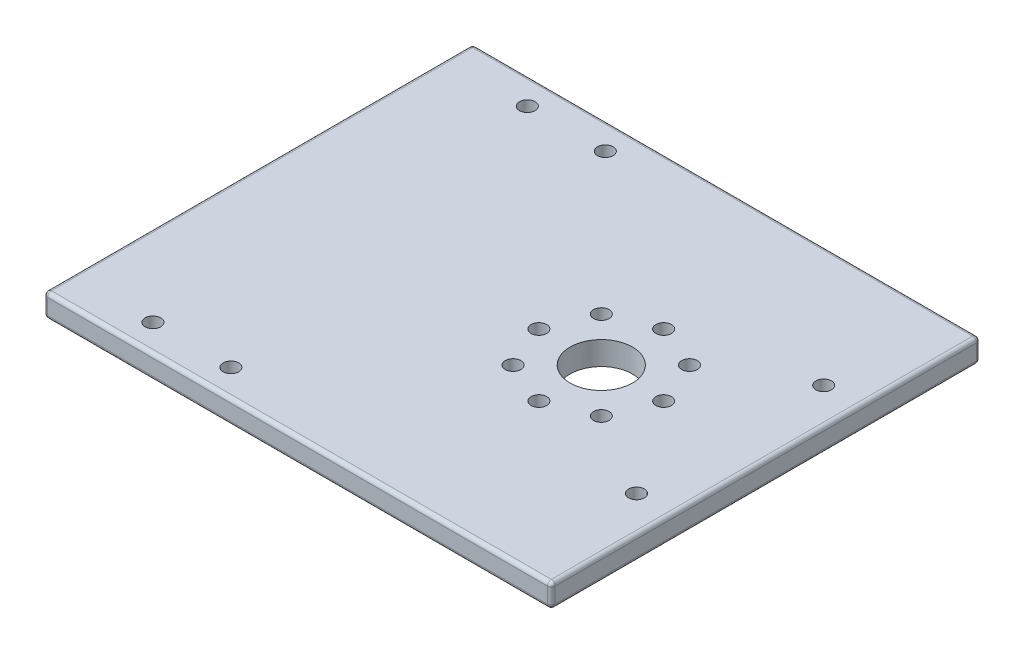
from build123d import *

# Parameters (mm, degrees)
SKETCH1_W           = 65.079845806
SKETCH1_H           = 55
SKETCH1_R           = 4
BOSS_EXTRUDE1_DEPTH = 3
SKETCH2_R           = 1
CUT_EXTRUDE1_DEPTH  = 3
FILLET1_R           = 0.5
SKETCH3_R           = 1
CUT_EXTRUDE2_DEPTH  = 52.961426281


with BuildPart() as part:
    # Sketch1 → Boss-Extrude1 (new body)
    with BuildSketch(Plane(origin=(0, 548.352995908, 0), x_dir=(1, 0, 0), z_dir=(0, 1, 0))):
        with Locations((-11.445754552, 0)):
            Rectangle(SKETCH1_W, SKETCH1_H)
        with Locations(Location((0, 0, 0), (0, 0, 270))):
            Circle(SKETCH1_R, mode=Mode.SUBTRACT)
    extrude(amount=BOSS_EXTRUDE1_DEPTH)

    # Sketch2 → Cut-Extrude1 (cut)
    with BuildSketch(Plane(origin=(0, 551.352995908, 0), x_dir=(1, 0, 0), z_dir=(0, 1, 0))):
        with Locations(Location((0, 8, 0), (0, 0, 270))):
            Circle(SKETCH2_R)
        with Locations(Location((5.656854249, 5.656854249, 0), (0, 0, 270))):
            Circle(SKETCH2_R)
        with Locations(Location((8, 0, 0), (0, 0, 270))):
            Circle(SKETCH2_R)
        with Locations(Location((5.656854249, -5.656854249, 0), (0, 0, 270))):
            Circle(SKETCH2_R)
        with Locations(Location((0, -8, 0), (0, 0, 270))):
            Circle(SKETCH2_R)
        with Locations(Location((-5.656854249, -5.656854249, 0), (0, 0, 270))):
            Circle(SKETCH2_R)
        with Locations(Location((-8, 0, 0), (0, 0, 270))):
            Circle(SKETCH2_R)
        with Locations(Location((-5.656854249, 5.656854249, 0), (0, 0, 270))):
            Circle(SKETCH2_R)
    extrude(amount=-CUT_EXTRUDE1_DEPTH, mode=Mode.SUBTRACT)

    # Fillet1
    fillet1_edges = [part.edges().sort_by_distance(p)[0] for p in [
        (21.094168351, 551.352995908, 0),
        (-11.445754552, 551.352995908, -27.5),
        (-43.985677455, 551.352995908, 0),
        (-11.445754552, 548.352995908, -27.5),
        (21.094168351, 548.352995908, 0),
        (-11.445754552, 548.352995908, 27.5),
        (-43.985677455, 548.352995908, 0),
        (-43.985677455, 549.852995908, -27.5),
        (21.094168351, 549.852995908, -27.5),
        (21.094168351, 549.852995908, 27.5),
        (-43.985677455, 549.852995908, 27.5),
        (-11.445754552, 551.352995908, 27.5),
    ]]
    fillet(fillet1_edges, radius=FILLET1_R)

    # Sketch3 → Cut-Extrude2 (cut, through all)
    with BuildSketch(Plane(origin=(0, 551.352995908, 0), x_dir=(1, 0, 0), z_dir=(0, 1, 0))):
        with Locations(Location((-33.485677455, -24, 0), (0, 0, 270))):
            Circle(SKETCH3_R)
        with Locations(Location((-23.485677455, -24, 0), (0, 0, 270))):
            Circle(SKETCH3_R)
        with Locations(Location((16.514322545, -12, 0), (0, 0, 270))):
            Circle(SKETCH3_R)
        with Locations(Location((16.514322545, 12, 0), (0, 0, 270))):
            Circle(SKETCH3_R)
        with Locations(Location((-23.485677455, 24, 0), (0, 0, 270))):
            Circle(SKETCH3_R)
        with Locations(Location((-33.485677455, 24, 0), (0, 0, 270))):
            Circle(SKETCH3_R)
    extrude(amount=-CUT_EXTRUDE2_DEPTH, mode=Mode.SUBTRACT)


solid = part.part
